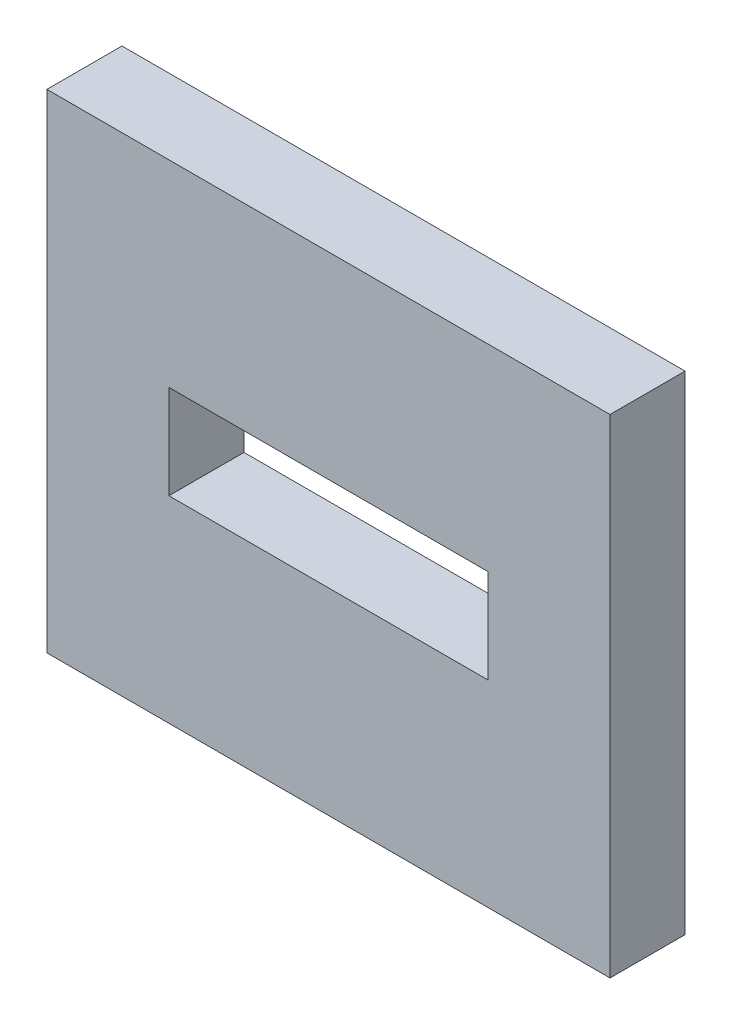
from build123d import *

# Parameters (mm, degrees)
SKETCH1_W           = 15
SKETCH1_H           = 13
SKETCH1_W_2         = 8.5
SKETCH1_H_2         = 2.5
BOSS_EXTRUDE1_DEPTH = 2


with BuildPart() as part:
    # Sketch1 → Boss-Extrude1 (new body)
    with BuildSketch(Plane.XY):
        with Locations((0, 2.952384416)):
            Rectangle(SKETCH1_W, SKETCH1_H)
        with Locations((0, 2.952384416)):
            Rectangle(SKETCH1_W_2, SKETCH1_H_2, mode=Mode.SUBTRACT)
    extrude(amount=BOSS_EXTRUDE1_DEPTH)


solid = part.part
